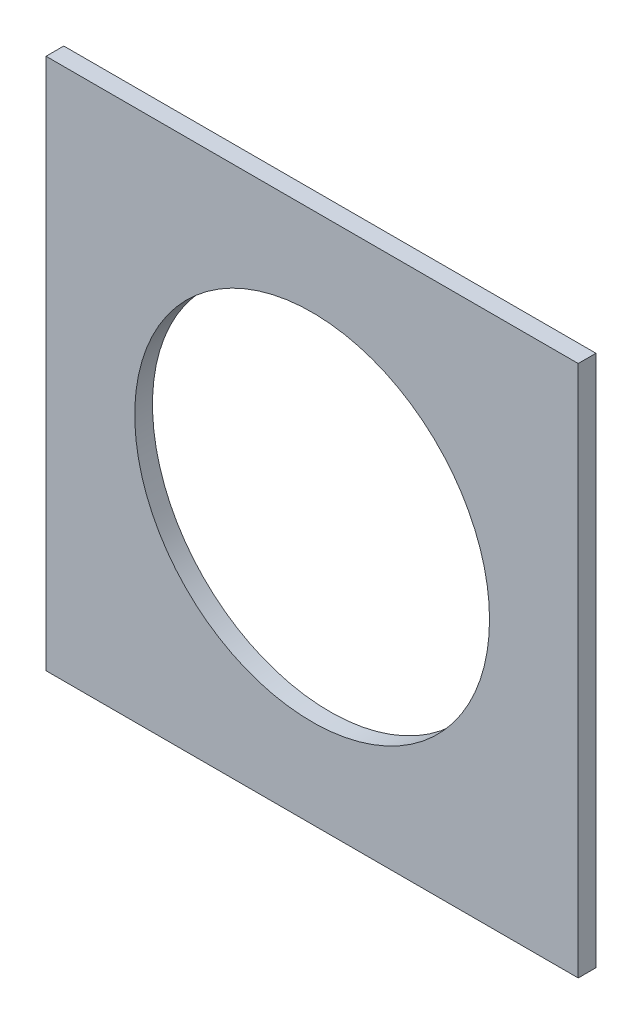
from build123d import *

# Parameters (mm, degrees)
SKETCH1_W           = 30
SKETCH1_H           = 30
SKETCH1_R           = 10
BOSS_EXTRUDE1_DEPTH = 1


with BuildPart() as part:
    # Sketch1 → Boss-Extrude1 (new body)
    with BuildSketch(Plane.XY):
        Rectangle(SKETCH1_W, SKETCH1_H)
        Circle(SKETCH1_R, mode=Mode.SUBTRACT)
    extrude(amount=BOSS_EXTRUDE1_DEPTH)


solid = part.part
